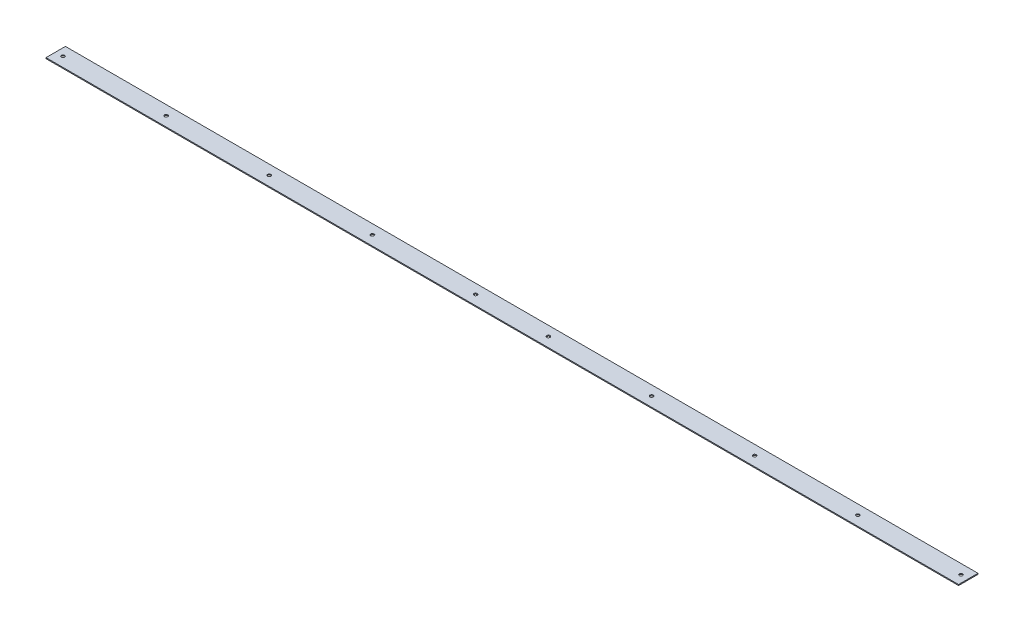
from build123d import *

# Parameters (mm, degrees)
SKETCH1_W           = 1880
SKETCH1_H           = 40
BOSS_EXTRUDE1_DEPTH = 2
SKETCH2_R           = 3.4
CUT_EXTRUDE1_DEPTH  = 10


with BuildPart() as part:
    # Sketch1 → Boss-Extrude1 (new body)
    with BuildSketch(Plane(origin=(0, 0, 0), x_dir=(1, 0, 0), z_dir=(0, 1, 0))):
        Rectangle(SKETCH1_W, SKETCH1_H)
    extrude(amount=BOSS_EXTRUDE1_DEPTH)

    # Sketch2 → Cut-Extrude1 (cut)
    with BuildSketch(Plane(origin=(0, 2, 0), x_dir=(1, 0, 0), z_dir=(0, 1, 0))):
        with Locations(Location((-925, 0, 0), (0, 0, 270))):
            Circle(SKETCH2_R)
        with Locations(Location((-712.5, 0, 0), (0, 0, 270))):
            Circle(SKETCH2_R)
        with Locations(Location((-500, 0, 0), (0, 0, 270))):
            Circle(SKETCH2_R)
        with Locations(Location((-287.5, 0, 0), (0, 0, 270))):
            Circle(SKETCH2_R)
        with Locations(Location((-75, 0, 0), (0, 0, 270))):
            Circle(SKETCH2_R)
        with Locations(Location((925, 0, 0), (0, 0, 270))):
            Circle(SKETCH2_R)
        with Locations(Location((712.5, 0, 0), (0, 0, 270))):
            Circle(SKETCH2_R)
        with Locations(Location((500, 0, 0), (0, 0, 270))):
            Circle(SKETCH2_R)
        with Locations(Location((287.5, 0, 0), (0, 0, 270))):
            Circle(SKETCH2_R)
        with Locations(Location((75, 0, 0), (0, 0, 270))):
            Circle(SKETCH2_R)
    extrude(amount=-CUT_EXTRUDE1_DEPTH, mode=Mode.SUBTRACT)


solid = part.part
